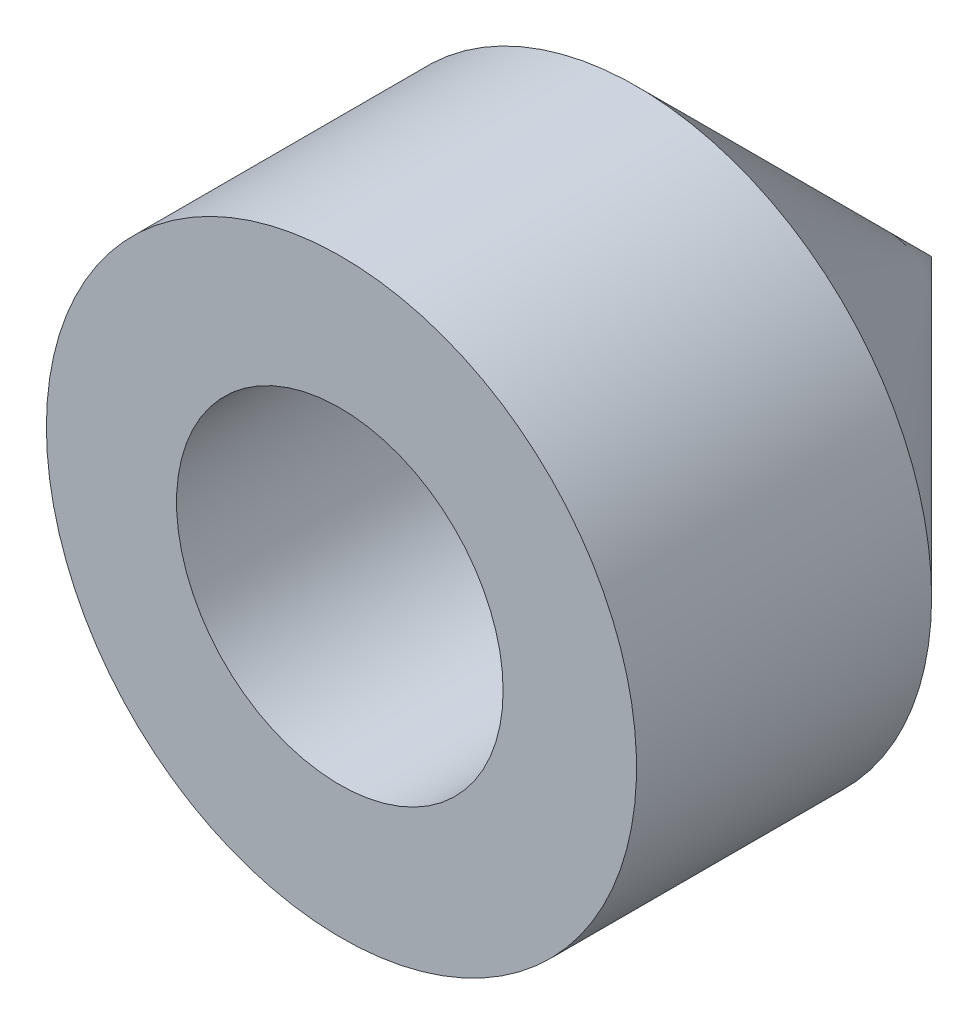
from build123d import *

# Parameters (mm, degrees)
SKETCH2_R          = 11.067551778
CUT_EXTRUDE1_DEPTH = 20


with BuildPart() as part:
    # Sketch1 → Revolve1 (revolve)
    with BuildSketch(Plane(origin=(0, 0, 0), x_dir=(1, 0, 0), z_dir=(0, 1, 0))):
        Polygon((-30.088085187, 106.291847852), (-30.088085187, 86.291847852), (-30.088085187, 66.291847852), (-10.088085187, 66.291847852), (-10.088085187, 86.291847852), align=None)
    revolve(axis=Axis((-30.088085187, 0, -86.291847852), (0, 0, 1)))

    # Sketch2 → Cut-Extrude1 (cut)
    with BuildSketch(Plane.XY.offset(-66.291847852)):
        with Locations((-30.198913781, 0)):
            Circle(SKETCH2_R)
    extrude(amount=-CUT_EXTRUDE1_DEPTH, mode=Mode.SUBTRACT)


solid = part.part
